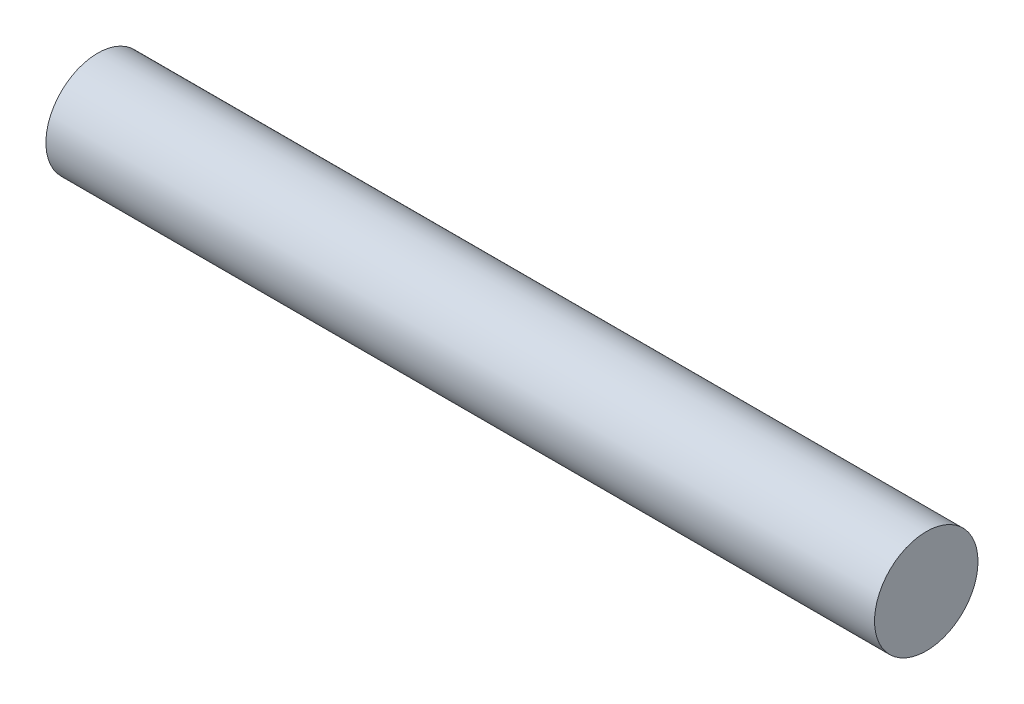
from build123d import *

# Parameters (mm, degrees)
SKETCH1_R           = 1
BOSS_EXTRUDE1_DEPTH = 8.008609275


with BuildPart() as part:
    # Sketch1 → Boss-Extrude1 (new, symmetric)
    with BuildSketch(Plane(origin=(0, 0, 0), x_dir=(0, 0, -1), z_dir=(1, 0, 0))):
        Circle(SKETCH1_R)
    extrude(amount=BOSS_EXTRUDE1_DEPTH, both=True)


solid = part.part
